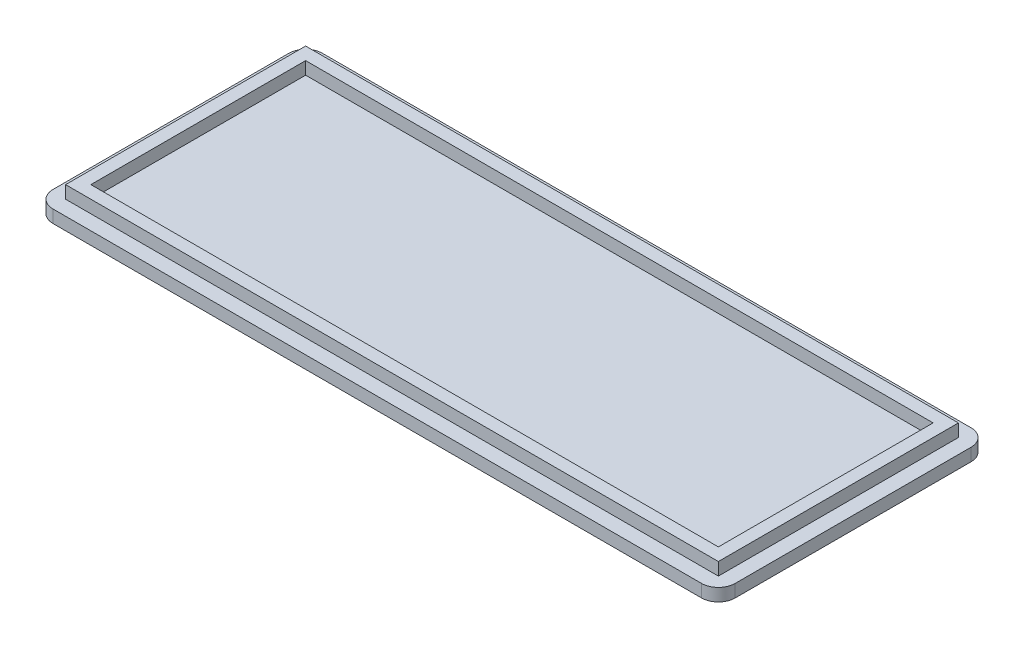
from build123d import *

# Parameters (mm, degrees)
BOSS_EXTRUDE1_DEPTH = 1.5
SKETCH2_W           = 77.5
SKETCH2_H           = 28.5
SKETCH2_W_2         = 74.5
SKETCH2_H_2         = 25.5
BOSS_EXTRUDE2_DEPTH = 1.5


with BuildPart() as part:
    # Sketch1 → Boss-Extrude1 (new body)
    with BuildSketch(Plane(origin=(0, 0, 0), x_dir=(1, 0, 0), z_dir=(0, 1, 0))):
        with BuildLine():
            Line((-76.546897521, -86.290788706), (-153.546897521, -86.290788706))
            ThreePointArc((-153.546897521, -86.290788706), (-154.961111084, -85.705002268), (-155.546897521, -84.290788706))
            Line((-155.546897521, -84.290788706), (-155.546897521, -56.290788706))
            ThreePointArc((-155.546897521, -56.290788706), (-154.961111084, -54.876575144), (-153.546897521, -54.290788706))
            Line((-153.546897521, -54.290788706), (-76.546897521, -54.290788706))
            ThreePointArc((-76.546897521, -54.290788706), (-75.132683959, -54.876575144), (-74.546897521, -56.290788706))
            Line((-74.546897521, -56.290788706), (-74.546897521, -84.290788706))
            ThreePointArc((-74.546897521, -84.290788706), (-75.132683959, -85.705002268), (-76.546897521, -86.290788706))
        make_face()
    extrude(amount=BOSS_EXTRUDE1_DEPTH)

    # Sketch2 → Boss-Extrude2 (add)
    with BuildSketch(Plane(origin=(0, 1.5, 0), x_dir=(1, 0, 0), z_dir=(0, 1, 0))):
        with Locations((-115.046897521, -70.290788706)):
            Rectangle(SKETCH2_W, SKETCH2_H)
        with Locations((-115.046897521, -70.290788706)):
            Rectangle(SKETCH2_W_2, SKETCH2_H_2, mode=Mode.SUBTRACT)
    extrude(amount=BOSS_EXTRUDE2_DEPTH)


solid = part.part
